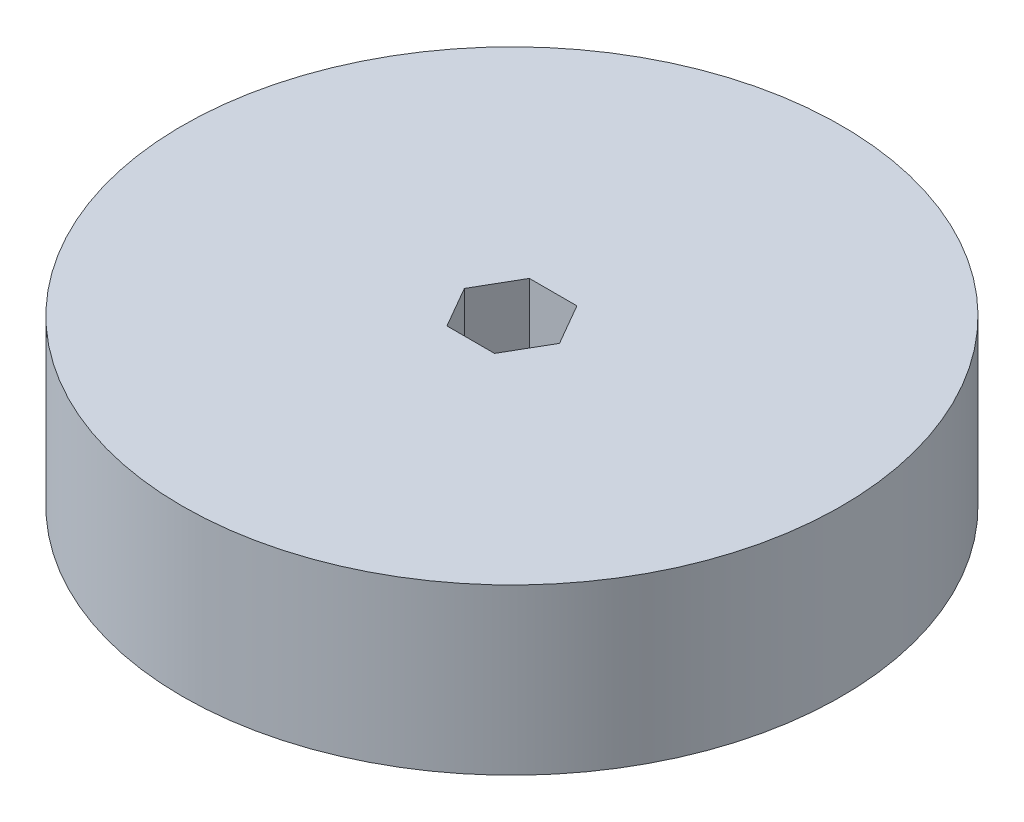
from build123d import *

# Parameters (mm, degrees)
SKETCH1_R           = 50.8
BOSS_EXTRUDE1_DEPTH = 25.4
CUT_EXTRUDE1_DEPTH  = 77.2


with BuildPart() as part:
    # Sketch1 → Boss-Extrude1 (new body)
    with BuildSketch(Plane(origin=(0, 0, 0), x_dir=(1, 0, 0), z_dir=(0, 1, 0))):
        with Locations(Location((0, 0, 0), (0, 0, 270))):
            Circle(SKETCH1_R)
    extrude(amount=BOSS_EXTRUDE1_DEPTH)

    # Sketch2 → Cut-Extrude1 (cut, through all)
    with BuildSketch(Plane(origin=(0, 25.4, 0), x_dir=(1, 0, 0), z_dir=(0, 1, 0))):
        Polygon((3.666174209, 6.35), (-3.666174209, 6.35), (-7.332348419, 0), (-3.666174209, -6.35), (3.666174209, -6.35), (7.332348419, 0), align=None)
    extrude(amount=-CUT_EXTRUDE1_DEPTH, mode=Mode.SUBTRACT)


solid = part.part
